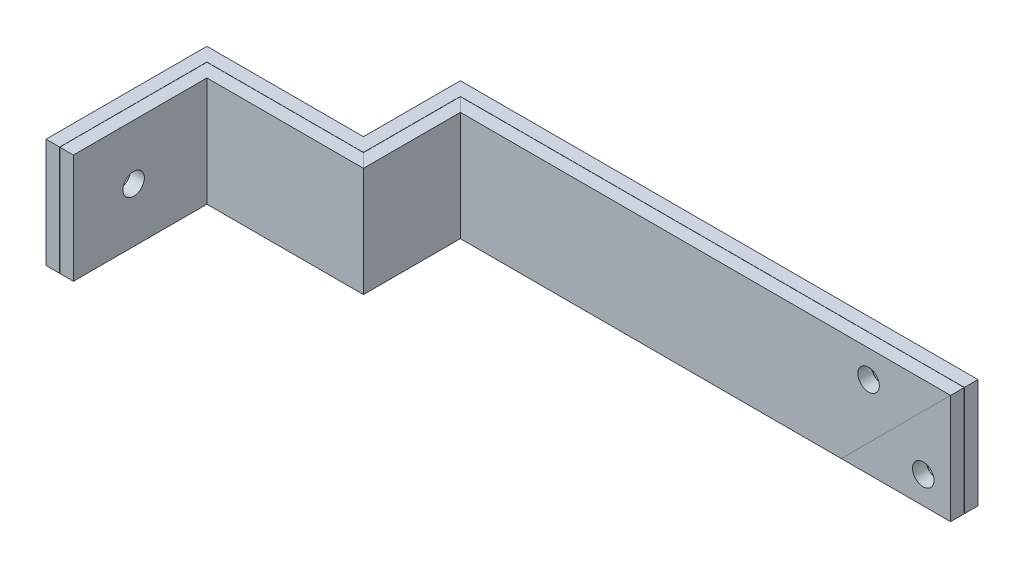
from build123d import *

# Parameters (mm, degrees)
CROQUIS2_W              = 6.31
CROQUIS2_H              = 50.8
CROQUIS3_W              = 6.31
CROQUIS3_H              = 50.8
SALIENTE_EXTRUIR1_DEPTH = 62
CROQUIS4_W              = 6.31
CROQUIS4_H              = 50.8
SALIENTE_EXTRUIR2_DEPTH = 40
CROQUIS5_R              = 6.35
CORTAR_EXTRUIR1_DEPTH   = 10
CROQUIS6_W              = 50.8
CROQUIS6_H              = 6.31
SALIENTE_EXTRUIR3_DEPTH = 50.8
CROQUIS7_W              = 50.8
CROQUIS7_H              = 362.6
CORTAR_EXTRUIR2_DEPTH   = 67
CROQUIS8_W              = 50.8
CROQUIS8_H              = 50.8
CORTAR_EXTRUIR3_DEPTH   = 67
SALIENTE_EXTRUIR4_DEPTH = 50.8
CROQUIS10_R             = 5
CORTAR_EXTRUIR4_DEPTH   = 24.525
CROQUIS11_R             = 5
CORTAR_EXTRUIR5_DEPTH   = 35


with BuildPart() as part:
    # Barrer1: sweep along a curve in space
    with BuildLine() as barrer1_path:
        Line((0, 0, 0), (75.84, 0, 0))
        Line((75.84, 0, 0), (75.84, 0, -45))
        Line((75.84, 0, -45), (281.23, 0, -45))
        Line((281.23, 0, -45), (281.23, -388, -45))
    # Croquis2 → Barrer1 (sweep)
    with BuildSketch(Plane(origin=(0, 0, 0), x_dir=(0, 0, -1), z_dir=(1, 0, 0))):
        Rectangle(CROQUIS2_W, CROQUIS2_H)
    sweep(path=barrer1_path.line, transition=Transition.RIGHT)

    # Croquis3 → Saliente-Extruir1 (add)
    with BuildSketch(Plane.XY.offset(3.155)):
        with Locations((3.155, 0)):
            Rectangle(CROQUIS3_W, CROQUIS3_H)
    extrude(amount=SALIENTE_EXTRUIR1_DEPTH)

    # Croquis4 → Saliente-Extruir2 (add)
    with BuildSketch(Plane.XY.offset(-41.845)):
        with Locations((258.985, -362.6)):
            Rectangle(CROQUIS4_W, CROQUIS4_H)
    extrude(amount=SALIENTE_EXTRUIR2_DEPTH)

    # Croquis5 → Cortar-Extruir1 (cut)
    with BuildSketch(Plane(origin=(262.14, 0, 0), x_dir=(0, 0, -1), z_dir=(1, 0, 0))):
        with Locations(Location((16.155, -346.6, 0), (0, 0, 90))):
            Circle(CROQUIS5_R)
        with Locations(Location((16.155, -378.6, 0), (0, 0, 90))):
            Circle(CROQUIS5_R)
    extrude(amount=-CORTAR_EXTRUIR1_DEPTH, mode=Mode.SUBTRACT)

    # Croquis6 → Saliente-Extruir3 (add)
    with BuildSketch(Plane.ZY):
        with Locations((39.755, 22.245)):
            Rectangle(CROQUIS6_W, CROQUIS6_H)
    extrude(amount=SALIENTE_EXTRUIR3_DEPTH)

    # Croquis7 → Cortar-Extruir2 (cut)
    with BuildSketch(Plane(origin=(0, 0, -48.155), x_dir=(-1, 0, 0), z_dir=(0, 0, -1))):
        with Locations((-281.23, -206.7)):
            Rectangle(CROQUIS7_W, CROQUIS7_H)
    extrude(amount=-CORTAR_EXTRUIR2_DEPTH, mode=Mode.SUBTRACT)

    # Croquis8 → Cortar-Extruir3 (cut)
    with BuildSketch(Plane.XZ.offset(-19.09)):
        with Locations((-25.4, 39.755)):
            Rectangle(CROQUIS8_W, CROQUIS8_H)
    extrude(amount=-CORTAR_EXTRUIR3_DEPTH, mode=Mode.SUBTRACT)


with BuildPart() as body_2:
    # Croquis9 → Saliente-Extruir4 (new body)
    with BuildSketch(Plane.XZ.offset(25.4)):
        Polygon((-0.1, 65.155), (-1.925533234, 65.155), (-6.41, 65.155), (-6.41, -9.565), (66.275, -9.565), (66.275, -54.565), (306.63, -54.565), (306.63, -48.255), (72.585, -48.255), (72.585, -3.255), (-0.1, -3.255), align=None)
    extrude(amount=-SALIENTE_EXTRUIR4_DEPTH)


with BuildPart() as cortar_extruir4_tool:
    # Croquis10 → Cortar-Extruir4 (new body)
    with BuildSketch(Plane(origin=(6.31, 0, 0), x_dir=(0, 0, -1), z_dir=(1, 0, 0))):
        with Locations((-37.195, -0.172201783)):
            Circle(CROQUIS10_R)
    extrude(amount=-CORTAR_EXTRUIR4_DEPTH)


with BuildPart() as part_1:
    add(part.part)

    # Cortar-Extruir4: cut by cortar_extruir4_tool
    add(cortar_extruir4_tool.part, mode=Mode.SUBTRACT)


with BuildPart() as body_2_1:
    add(body_2.part)

    # Cortar-Extruir4: cut by cortar_extruir4_tool
    add(cortar_extruir4_tool.part, mode=Mode.SUBTRACT)


with BuildPart() as cortar_extruir5_tool:
    # Croquis11 → Cortar-Extruir5 (new body)
    with BuildSketch(Plane.XY.offset(-41.845)):
        with Locations((293.93, -12.7)):
            Circle(CROQUIS11_R)
        with Locations((268.53, 12.7)):
            Circle(CROQUIS11_R)
    extrude(amount=-CORTAR_EXTRUIR5_DEPTH)


with BuildPart() as part_2:
    add(part_1.part)

    # Cortar-Extruir5: cut by cortar_extruir5_tool
    add(cortar_extruir5_tool.part, mode=Mode.SUBTRACT)


with BuildPart() as body_2_2:
    add(body_2_1.part)

    # Cortar-Extruir5: cut by cortar_extruir5_tool
    add(cortar_extruir5_tool.part, mode=Mode.SUBTRACT)


solid = Compound([part_2.part, body_2_2.part])
